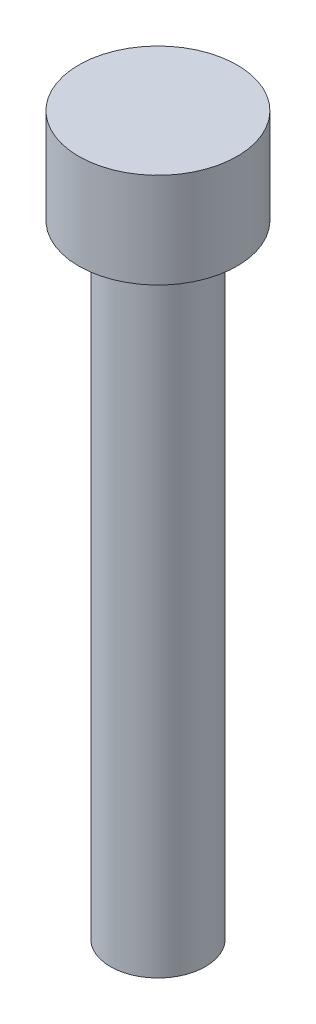
from build123d import *

# Parameters (mm, degrees)
SKETCH1_R           = 3
BOSS_EXTRUDE1_DEPTH = 39.3
SKETCH2_R           = 5
BOSS_EXTRUDE2_DEPTH = 6


with BuildPart() as part:
    # Sketch1 → Boss-Extrude1 (new body)
    with BuildSketch(Plane(origin=(0, 0, 0), x_dir=(1, 0, 0), z_dir=(0, 1, 0))):
        with Locations(Location((0, 0, 0), (0, 0, 270))):
            Circle(SKETCH1_R)
    extrude(amount=BOSS_EXTRUDE1_DEPTH)

    # Sketch2 → Boss-Extrude2 (add)
    with BuildSketch(Plane(origin=(0, 39.3, 0), x_dir=(1, 0, 0), z_dir=(0, 1, 0))):
        with Locations(Location((0, 0, 0), (0, 0, 270))):
            Circle(SKETCH2_R)
    extrude(amount=BOSS_EXTRUDE2_DEPTH)


solid = part.part
